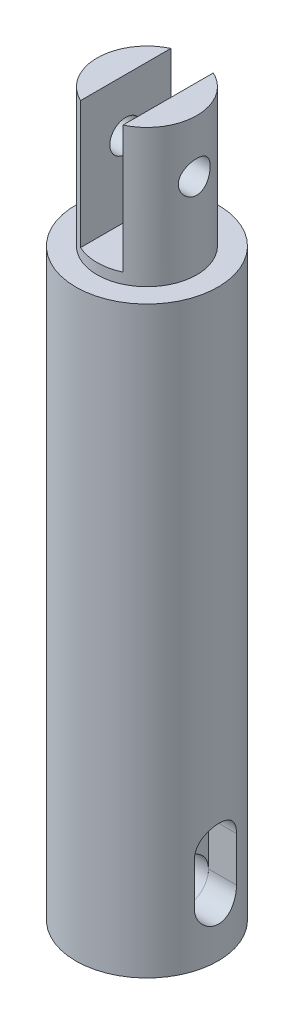
from build123d import *

# Parameters (mm, degrees)
SKETCH1_R               = 3.35
BOSS_EXTRUDE1_DEPTH     = 27.5
SKETCH2_R               = 2.35
BOSS_EXTRUDE2_DEPTH     = 6.5
SKETCH3_W               = 2
SKETCH3_H               = 5.353995574
CUT_EXTRUDE1_DEPTH      = 6
CUT_EXTRUDE3_DEPTH      = 6
CUT_EXTRUDE3_DEPTH_BACK = 6
SKETCH4_R               = 0.75
CUT_EXTRUDE6_DEPTH      = 1.5
SKETCH8_R               = 1
CUT_EXTRUDE7_DEPTH      = 2
SKETCH10_R              = 0.75
CUT_EXTRUDE8_DEPTH      = 26


with BuildPart() as part:
    # Sketch1 → Boss-Extrude1 (new body)
    with BuildSketch(Plane(origin=(0, 0, 0), x_dir=(1, 0, 0), z_dir=(0, 1, 0))):
        with Locations(Location((0, 0, 0), (0, 0, 270))):
            Circle(SKETCH1_R)
    extrude(amount=BOSS_EXTRUDE1_DEPTH)

    # Sketch2 → Boss-Extrude2 (add)
    with BuildSketch(Plane(origin=(0, 27.5, 0), x_dir=(1, 0, 0), z_dir=(0, 1, 0))):
        with Locations(Location((0, 0, 0), (0, 0, 90))):
            Circle(SKETCH2_R)
    extrude(amount=BOSS_EXTRUDE2_DEPTH)

    # Sketch3 → Cut-Extrude1 (cut)
    with BuildSketch(Plane(origin=(0, 34, 0), x_dir=(1, 0, 0), z_dir=(0, 1, 0))):
        Rectangle(SKETCH3_W, SKETCH3_H)
    extrude(amount=-CUT_EXTRUDE1_DEPTH, mode=Mode.SUBTRACT)

    # Sketch4 → Cut-Extrude3 (cut, two sides: drawn at the far end of the back side and taken through both)
    with BuildSketch(Plane(origin=(0, 0, 0), x_dir=(0, 0, -1), z_dir=(1, 0, 0)).offset(-CUT_EXTRUDE3_DEPTH_BACK)):
        with Locations(Location((0, 31.5, 0), (0, 0, 180))):
            Circle(SKETCH4_R)
    extrude(amount=CUT_EXTRUDE3_DEPTH + CUT_EXTRUDE3_DEPTH_BACK, mode=Mode.SUBTRACT)

    # 3DSketch1 → Cut-Extrude6 (cut, along a direction that is not the sketch's normal)
    with BuildSketch(Plane(origin=(3.377344649, 4.599804895, 0.965668213), x_dir=(-0.0037402599842756385, -0.7241400829748917, -0.6896427703415493), z_dir=(-0.9999852932865704, 0, 0.0054233947460823675))):
        with BuildLine():
            Line((0, 0), (1.520694174, 1.448271117))
            ThreePointArc((1.520694174, 1.448271117), (2.934478337, 1.413784162), (2.899991382, 0))
            Line((2.899991382, 0), (1.379297208, -1.448271117))
            ThreePointArc((1.379297208, -1.448271117), (-0.034486955, -1.413784162), (0, 0))
        make_face()
    extrude(amount=CUT_EXTRUDE6_DEPTH, dir=(-1, 0, 0), mode=Mode.SUBTRACT)

    # Sketch8 → Cut-Extrude7 (cut)
    with BuildSketch(Plane(origin=(1.872052307, 0, -0.010153028), x_dir=(-0.005423394746082349, 0, -0.9999852932865705), z_dir=(0.9999852932865705, -1.3296655443362232e-15, -0.005423394746082349))):
        with Locations((0.02, 2.489689768)):
            Circle(SKETCH8_R)
    extrude(amount=-CUT_EXTRUDE7_DEPTH, mode=Mode.SUBTRACT)

    # Sketch10 → Cut-Extrude8 (cut)
    with BuildSketch(Plane(origin=(0, 27.5, 0), x_dir=(1, 0, 0), z_dir=(0, 1, 0))):
        with Locations(Location((0, 0, 0), (0, 0, 270))):
            Circle(SKETCH10_R)
    extrude(amount=-CUT_EXTRUDE8_DEPTH, mode=Mode.SUBTRACT)


solid = part.part
